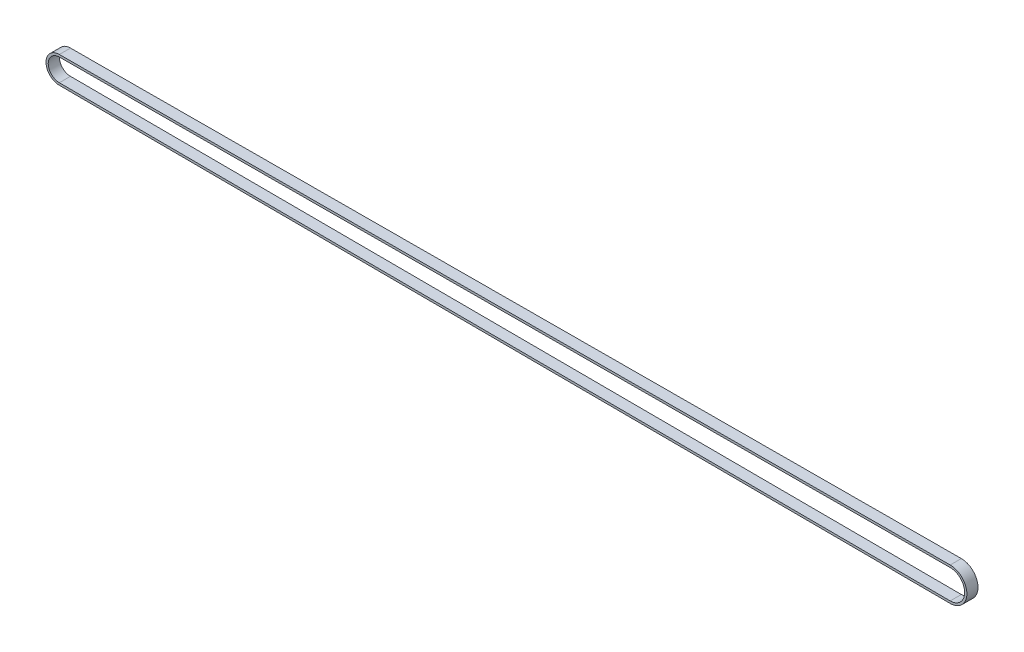
from build123d import *

# Parameters (mm, degrees)
BOSS_EXTRU_1_DEPTH = 5


with BuildPart() as part:
    # Esquisse1 → Boss.-Extru.1 (new body)
    with BuildSketch(Plane.XY):
        with BuildLine():
            Line((-400.5, 6), (0, 7.5))
            ThreePointArc((0, 7.5), (7.5, 0), (0, -7.5))
            Line((0, -7.5), (-400.5, -6))
            ThreePointArc((-400.5, -6), (-406.5, 0), (-400.5, 6))
        make_face()
        with BuildLine():
            Line((-400.5, 5), (0, 6.5))
            ThreePointArc((0, 6.5), (6.5, 0), (0, -6.5))
            Line((0, -6.5), (-400.5, -5))
            ThreePointArc((-400.5, -5), (-405.5, 0), (-400.5, 5))
        make_face(mode=Mode.SUBTRACT)
    extrude(amount=BOSS_EXTRU_1_DEPTH)


solid = part.part
